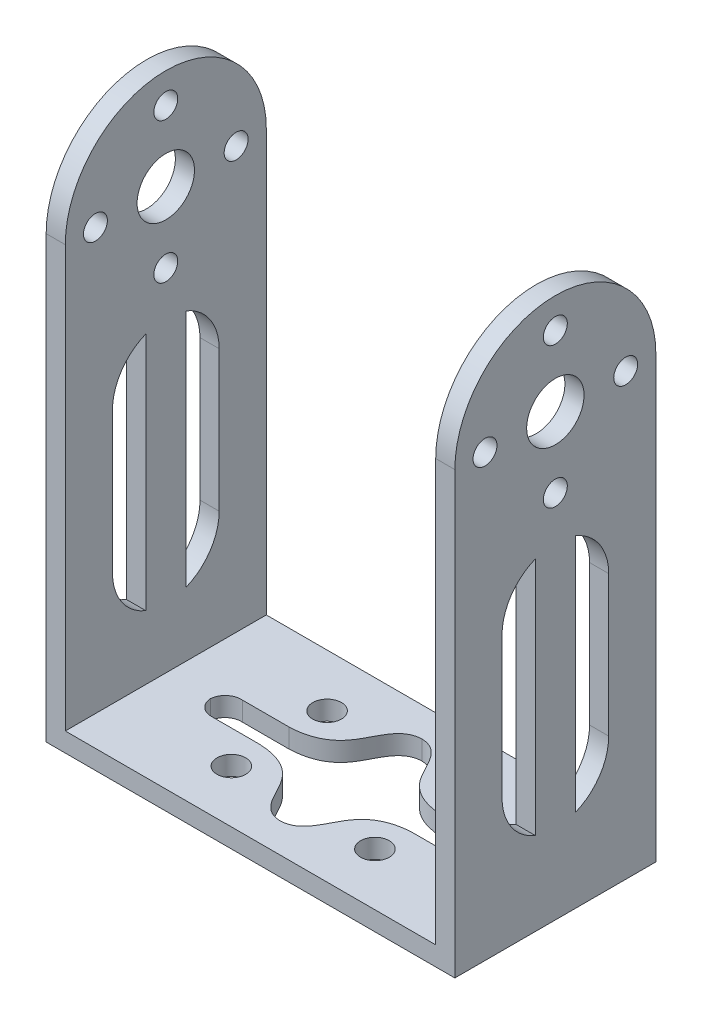
from build123d import *

# Parameters (mm, degrees)
SKETCH_1_W      = 42.7
SKETCH_1_H      = 21
SKETCH_1_R      = 1.5
EXTRUDE_1_DEPTH = 2
SKETCH_2_R      = 1.25
SKETCH_2_R_2    = 3
EXTRUDE_2_DEPTH = 2


with BuildPart() as part:
    # 草图1 → 凸台-拉伸1 (new body)
    with BuildSketch(Plane(origin=(0, 0, 0), x_dir=(1, 0, 0), z_dir=(0, 1, 0))):
        Rectangle(SKETCH_1_W, SKETCH_1_H)
        with Locations(Location((7.5, 5, 0), (0, 0, 270))):
            Circle(SKETCH_1_R, mode=Mode.SUBTRACT)
        with Locations(Location((7.5, -5, 0), (0, 0, 90))):
            Circle(SKETCH_1_R, mode=Mode.SUBTRACT)
        with Locations(Location((-7.5, -5, 0), (0, 0, 270))):
            Circle(SKETCH_1_R, mode=Mode.SUBTRACT)
        with Locations(Location((-7.5, 5, 0), (0, 0, 90))):
            Circle(SKETCH_1_R, mode=Mode.SUBTRACT)
        with BuildLine():
            Line((8.017950723, 1.550908082), (12.912587519, 1.550908082))
            ThreePointArc((12.912587519, 1.550908082), (14.126270768, 1.145131224), (14.697546856, 0))
            ThreePointArc((14.697546856, 0), (14.126270768, -1.145131224), (12.912587519, -1.550908082))
            Line((12.912587519, -1.550908082), (8.017950723, -1.550908082))
            add(Edge.make_bspline(
                [(0, -7.407271614), (2.092471107, -7.358009404), (3.043739342, -2.951912586), (6.007732496, -1.626733157), (8.017950723, -1.550908082)],
                knots=[0, 0, 0, 0, 0.496822763, 1, 1, 1, 1], degree=3))
            add(Edge.make_bspline(
                [(0, -7.407271614), (-2.092471107, -7.358009404), (-3.043739342, -2.951912586), (-6.007732496, -1.626733157), (-8.017950723, -1.550908082)],
                knots=[0, 0, 0, 0, 0.496822763, 1, 1, 1, 1], degree=3))
            Line((-8.017950723, -1.550908082), (-12.912587519, -1.550908082))
            ThreePointArc((-12.912587519, -1.550908082), (-14.126270768, -1.145131224), (-14.697546856, 0))
            ThreePointArc((-14.697546856, 0), (-14.126270768, 1.145131224), (-12.912587519, 1.550908082))
            Line((-12.912587519, 1.550908082), (-8.017950723, 1.550908082))
            add(Edge.make_bspline(
                [(0, 7.407271614), (-2.092471107, 7.358009404), (-3.043739342, 2.951912586), (-6.007732496, 1.626733157), (-8.017950723, 1.550908082)],
                knots=[0, 0, 0, 0, 0.496822763, 1, 1, 1, 1], degree=3))
            add(Edge.make_bspline(
                [(0, 7.407271614), (2.092471107, 7.358009404), (3.043739342, 2.951912586), (6.007732496, 1.626733157), (8.017950723, 1.550908082)],
                knots=[0, 0, 0, 0, 0.496822763, 1, 1, 1, 1], degree=3))
        make_face(mode=Mode.SUBTRACT)
    extrude(amount=EXTRUDE_1_DEPTH)

    # 草图2 → 凸台-拉伸2 (add)
    with BuildSketch(Plane.ZY.offset(21.35)):
        with BuildLine():
            Line((-10.5, 2), (-10.5, 46))
            ThreePointArc((-10.5, 46), (0, 56.5), (10.5, 46))
            Line((10.5, 46), (10.5, 2))
            Line((10.5, 2), (-10.5, 2))
        make_face()
        with Locations((0, 38.65)):
            Circle(SKETCH_2_R, mode=Mode.SUBTRACT)
        with Locations((-7.35, 46)):
            Circle(SKETCH_2_R, mode=Mode.SUBTRACT)
        with Locations((0, 53.35)):
            Circle(SKETCH_2_R, mode=Mode.SUBTRACT)
        with Locations((7.35, 46)):
            Circle(SKETCH_2_R, mode=Mode.SUBTRACT)
        with Locations((0, 46)):
            Circle(SKETCH_2_R_2, mode=Mode.SUBTRACT)
        with BuildLine():
            Line((-2.091438456, 33.71946821), (-2.091438456, 8.682620376))
            ThreePointArc((-2.091438456, 8.682620376), (-4.622608783, 10.734209017), (-5.574745456, 13.850179963))
            Line((-5.574745456, 13.850179963), (-5.574745456, 28.551908623))
            ThreePointArc((-5.574745456, 28.551908623), (-4.622608783, 31.667879569), (-2.091438456, 33.71946821))
        make_face(mode=Mode.SUBTRACT)
        with BuildLine():
            Line((5.574745456, 28.551908623), (5.574745456, 13.850179963))
            ThreePointArc((5.574745456, 13.850179963), (4.622608783, 10.734209017), (2.091438456, 8.682620376))
            Line((2.091438456, 8.682620376), (2.091438456, 33.71946821))
            ThreePointArc((2.091438456, 33.71946821), (4.622608783, 31.667879569), (5.574745456, 28.551908623))
        make_face(mode=Mode.SUBTRACT)
    extrude_2 = extrude(amount=-EXTRUDE_2_DEPTH)

    # 镜向1: 凸台-拉伸2 across plane
    add(extrude_2.mirror(Plane(origin=(0, 0, 0), x_dir=(0, 0, 1), z_dir=(1, 0, 0))))


solid = part.part
